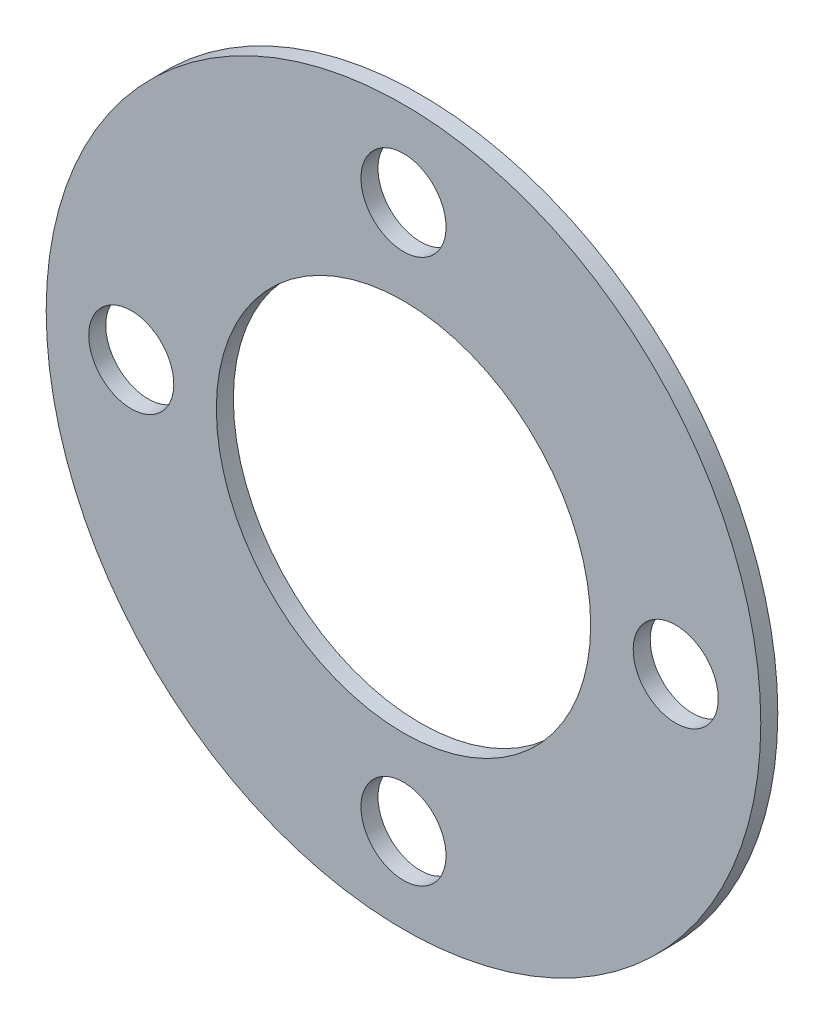
from build123d import *

# Parameters (mm, degrees)
SKETCH_1_R               = 21
SKETCH_1_R_2             = 11
EXTRUDE_1_DEPTH          = 1
SKETCH_2_R               = 2.5
CUT_EXTRUDE_1_DEPTH      = 30.715315916
PATTERN_CIRCULAR_1_COUNT = 4


with BuildPart() as part:
    # Эскиз1 → Бобышка-Вытянуть1 (new body)
    with BuildSketch(Plane.XY):
        Circle(SKETCH_1_R)
        Circle(SKETCH_1_R_2, mode=Mode.SUBTRACT)
    extrude(amount=EXTRUDE_1_DEPTH)

    # Эскиз2 → Вырез-Вытянуть1 (cut, through all)
    with BuildSketch(Plane.XY.offset(1)):
        with Locations((0, 16)):
            Circle(SKETCH_2_R)
    cut_extrude_1 = extrude(amount=-CUT_EXTRUDE_1_DEPTH, mode=Mode.SUBTRACT)

    # Круговой массив1: Вырез-Вытянуть1 ×4 about axis
    pattern_circular_1_axis = Axis((0, 0, 0), (0, 0, 1))
    for i in range(1, PATTERN_CIRCULAR_1_COUNT):
        add(cut_extrude_1.rotate(pattern_circular_1_axis, i * 360 / PATTERN_CIRCULAR_1_COUNT), mode=Mode.SUBTRACT)


solid = part.part
